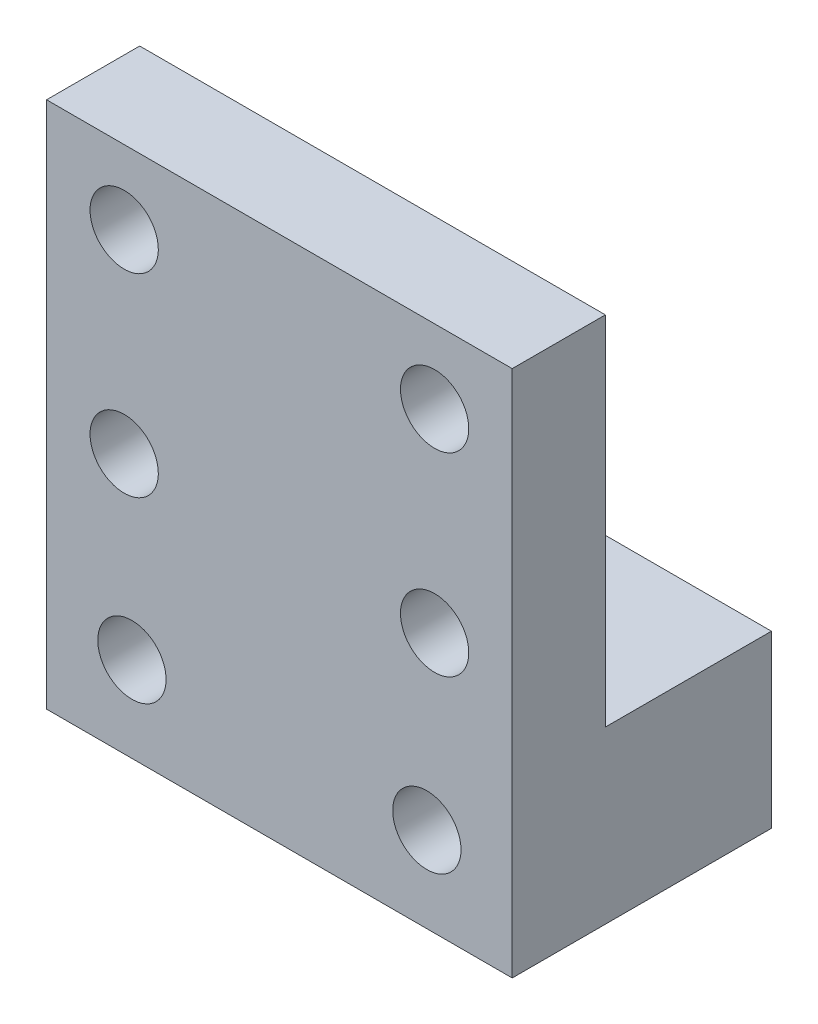
from build123d import *

# Parameters (mm, degrees)
SKETCH1_W           = 30
SKETCH1_H           = 34
BOSS_EXTRUDE1_DEPTH = 16.7
SKETCH2_W           = 10.7
SKETCH2_H           = 23
CUT_EXTRUDE1_DEPTH  = 49.94129136
HOLE1_D             = 4.4
HOLE2_D             = 4.4
HOLE3_D             = 4.4
HOLE4_D             = 4.4
HOLE5_D             = 4.4
HOLE6_D             = 4.4
HOLE7_D             = 8
HOLE7_DEPTH         = 34
RIB1_REACH          = 43.476
SKETCH17_WALL_W     = 108.907794566
SKETCH17_WALL_H     = 5


with BuildPart() as part:
    # Sketch1 → Boss-Extrude1 (new body)
    with BuildSketch(Plane.XY.offset(-8.3)):
        with Locations((-26.5, 12.5)):
            Rectangle(SKETCH1_W, SKETCH1_H)
    extrude(amount=-BOSS_EXTRUDE1_DEPTH)

    # Sketch2 → Cut-Extrude1 (cut, through all)
    with BuildSketch(Plane.ZY.offset(41.5)):
        with Locations((-19.65, 18)):
            Rectangle(SKETCH2_W, SKETCH2_H)
    extrude(amount=-CUT_EXTRUDE1_DEPTH, mode=Mode.SUBTRACT)

    # Hole1 (through all)
    with Locations(Plane(origin=(0, 0, -14.3), x_dir=(-1, 0, 0), z_dir=(0, 0, -1))):
        with Locations((16.5, 12.25)):
            Hole(HOLE1_D / 2)

    # Hole2 (through all)
    with Locations(Plane(origin=(0, 0, -14.3), x_dir=(-1, 0, 0), z_dir=(0, 0, -1))):
        with Locations((36.5, 12.25)):
            Hole(HOLE2_D / 2)

    # Hole3 (through all)
    with Locations(Plane(origin=(0, 0, -14.3), x_dir=(-1, 0, 0), z_dir=(0, 0, -1))):
        with Locations((36.5, 24.75)):
            Hole(HOLE3_D / 2)

    # Hole4 (through all)
    with Locations(Plane(origin=(0, 0, -14.3), x_dir=(-1, 0, 0), z_dir=(0, 0, -1))):
        with Locations((16.5, 24.75)):
            Hole(HOLE4_D / 2)

    # Hole5 (through all)
    with Locations(Plane(origin=(0, 0, -25), x_dir=(-1, 0, 0), z_dir=(0, 0, -1))):
        with Locations((36, 1)):
            Hole(HOLE5_D / 2)

    # Hole6 (through all)
    with Locations(Plane.XY.offset(-8.3)):
        with Locations((-17, 1)):
            Hole(HOLE6_D / 2)

    # Hole7
    with Locations(Plane.XZ.offset(4.5)):
        with Locations((-26.5, -25)):
            Hole(HOLE7_D / 2, depth=HOLE7_DEPTH)

    # Sketch17 wall → Rib1 (add, up to next)
    with BuildSketch(Plane(origin=(-26.5, 18, -17.65), x_dir=(0, -0.960093451224, -0.279679396661), z_dir=(0, -0.279679396661, 0.960093451224)), mode=Mode.PRIVATE) as rib1_sk1:
        Rectangle(SKETCH17_WALL_W, SKETCH17_WALL_H)
    rib1_tool1 = extrude(rib1_sk1.sketch, amount=RIB1_REACH, mode=Mode.PRIVATE) - part.part
    add(rib1_tool1.solids().sort_by_distance((-26.5, 18, -17.65))[0])


solid = part.part
